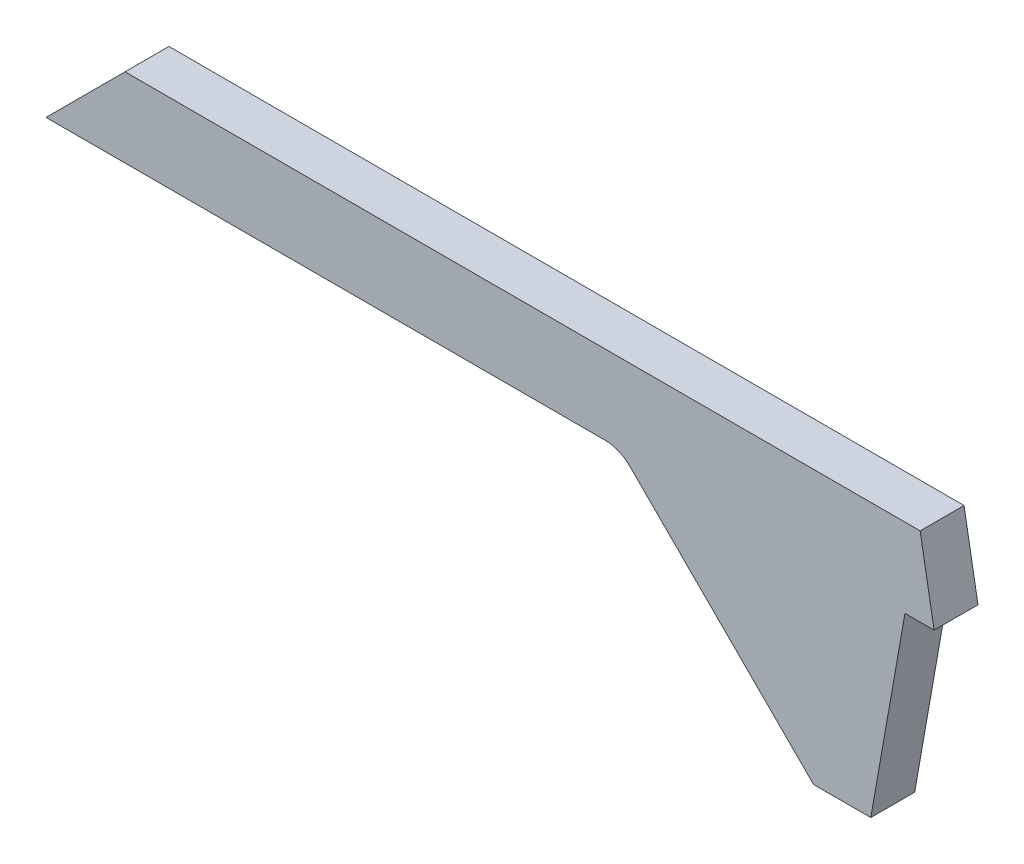
from build123d import *

# Parameters (mm, degrees)
BOSS_EXTRUDE1_DEPTH = 3.175


with BuildPart() as part:
    # Sketch1 → Boss-Extrude1 (new, symmetric)
    with BuildSketch(Plane.XY.offset(93)):
        with BuildLine():
            Line((786.672833799, -234.297326982), (778.40142943, -234.297326982))
            Line((778.40142943, -234.297326982), (751.84, -207.735897552))
            ThreePointArc((751.84, -207.735897552), (750.191929388, -206.634691975), (748.247897552, -206.248))
            Line((748.247897552, -206.248), (667.381261469, -206.248))
            Line((667.381261469, -206.248), (678.811261469, -194.818))
            Line((678.811261469, -194.818), (793.814823755, -194.818))
            Line((793.814823755, -194.818), (795.830241145, -206.248))
            Line((795.830241145, -206.248), (791.618686937, -206.248))
            Line((791.618686937, -206.248), (786.672833799, -234.297326982))
        make_face()
    extrude(amount=BOSS_EXTRUDE1_DEPTH, both=True)


solid = part.part
